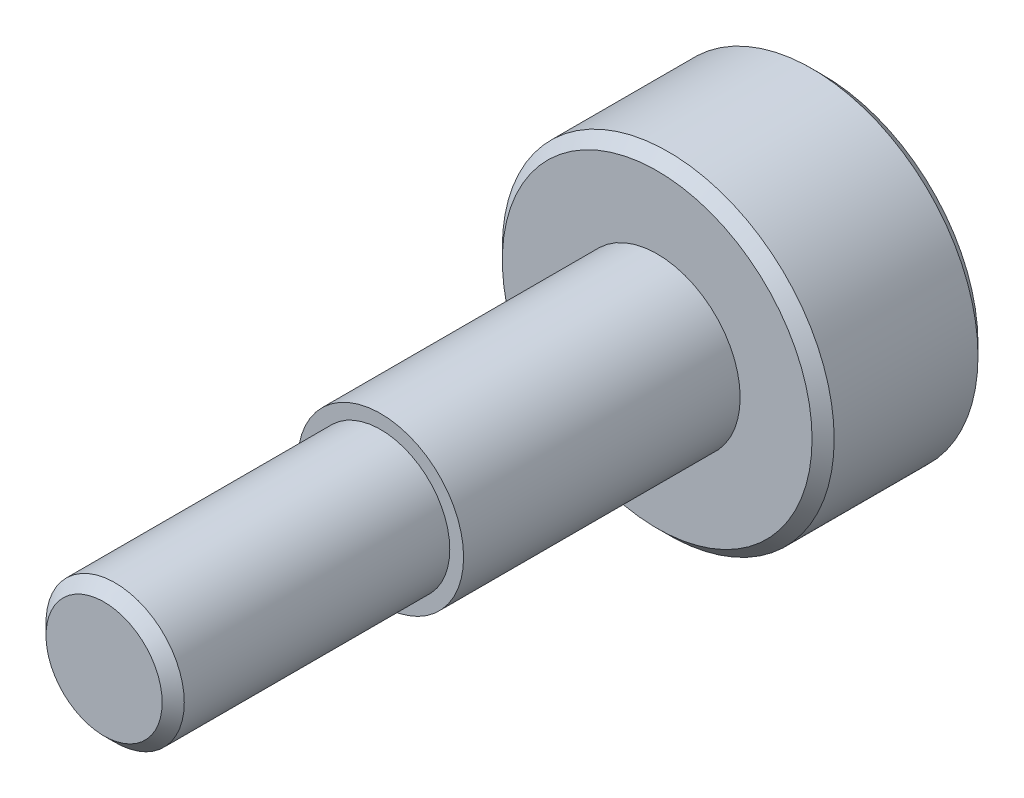
from build123d import *

# Parameters (mm, degrees)
SKETCH_1_R      = 3
EXTRUDE_1_DEPTH = 3
SKETCH_2_R      = 1.5
EXTRUDE_2_DEPTH = 5
SKETCH_3_R      = 1.25
EXTRUDE_3_DEPTH = 5
CHAMFER_1_SIZE  = 0.2


with BuildPart() as part:
    # 草图1 → 凸台-拉伸1 (new body)
    with BuildSketch(Plane.XY):
        Circle(SKETCH_1_R)
    extrude(amount=EXTRUDE_1_DEPTH)

    # 草图2 → 凸台-拉伸2 (add)
    with BuildSketch(Plane.XY.offset(3)):
        Circle(SKETCH_2_R)
    extrude(amount=EXTRUDE_2_DEPTH)

    # 草图3 → 凸台-拉伸3 (add)
    with BuildSketch(Plane.XY.offset(8)):
        Circle(SKETCH_3_R)
    extrude(amount=EXTRUDE_3_DEPTH)

    # 倒角1
    chamfer_1_edges = [part.edges().sort_by_distance(p)[0] for p in [
        (-1.25, 0, 13),
        (-3, 0, 0),
        (-3, 0, 3),
    ]]
    chamfer(chamfer_1_edges, length=CHAMFER_1_SIZE)


solid = part.part
